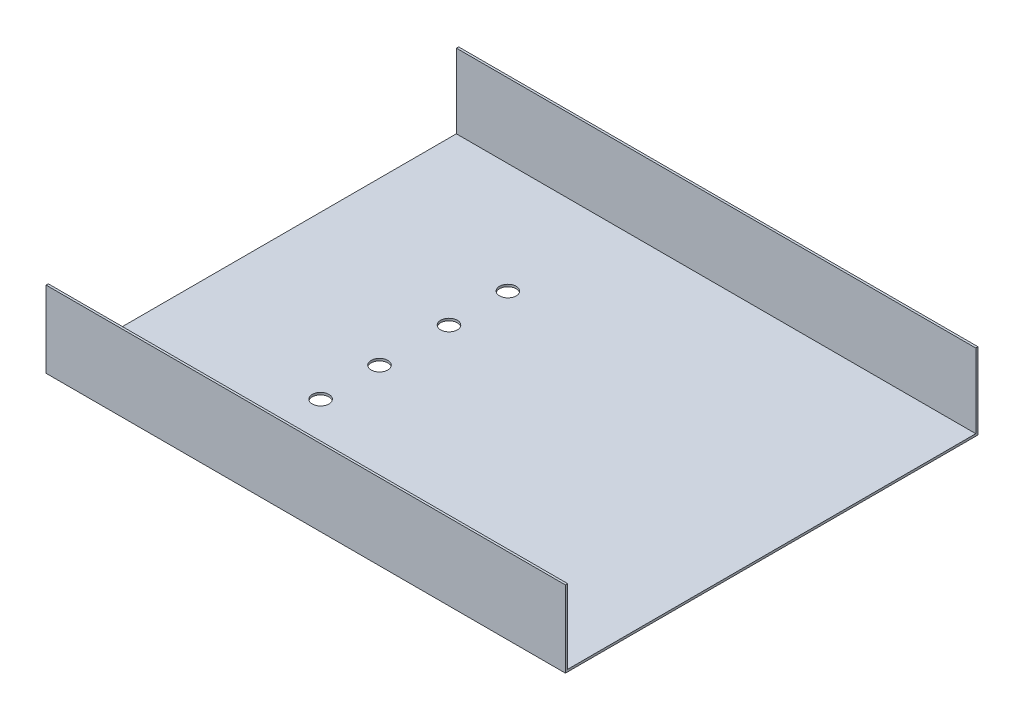
from build123d import *

# Parameters (mm, degrees)
CROQUIS1_W                   = 110
CROQUIS1_H                   = 20
SALIENTE_EXTRUIR1_DEPTH      = 140
VACIADO1_T                   = 0.6
TALADRO_DE_MARGEN_PARA_M42_D = 4.5


with BuildPart() as part:
    # Croquis1 → Saliente-Extruir1 (new body)
    with BuildSketch(Plane(origin=(0, 0, 0), x_dir=(0, 0, -1), z_dir=(1, 0, 0))):
        with Locations((55, 10)):
            Rectangle(CROQUIS1_W, CROQUIS1_H)
    extrude(amount=SALIENTE_EXTRUIR1_DEPTH)

    # Vaciado1
    vaciado1_openings = [part.faces().sort_by_distance(p)[0] for p in [
        (70, 20, -55),
        (0, 10, -55),
        (140, 10, -55),
    ]]
    offset(amount=VACIADO1_T, openings=vaciado1_openings, kind=Kind.INTERSECTION)

    # Taladro de margen para M42 (through all)
    with Locations(Plane(origin=(104.234059149, 1, -171.2), x_dir=(1, 0, 0), z_dir=(0, 1, 0))):
        with Locations((-60.584059149, -90.9625), (-60.584059149, -106.8375), (-60.584059149, -125.5625), (-60.584059149, -141.4375)):
            Hole(TALADRO_DE_MARGEN_PARA_M42_D / 2)


solid = part.part
